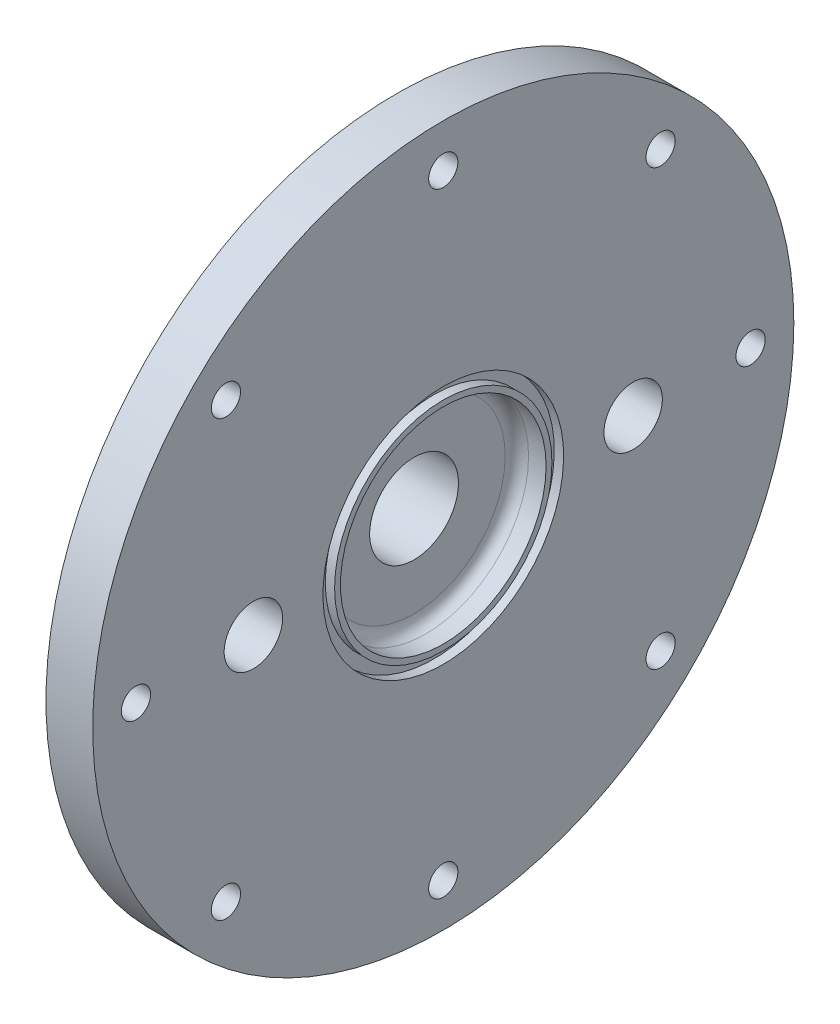
from build123d import *

# Parameters (mm, degrees)
CUT_EXTRUDE1_DEPTH      = 113.342968182
CUT_EXTRUDE1_DEPTH_BACK = 113.342968182
SKETCH2_R               = 6.35
SKETCH3_R               = 3.175
CUT_EXTRUDE2_DEPTH      = 113.342968182
CIRPATTERN1_COUNT       = 8
SKETCH4_W               = 2.032
SKETCH4_H               = 2.54


with BuildPart() as part:
    # Sketch1 → Revolve1 (revolve)
    with BuildSketch(Plane.XY, mode=Mode.PRIVATE) as revolve1_sk:
        with BuildLine():
            Line((0, 76.2), (-10.16, 76.2))
            Line((-10.16, 76.2), (-10.16, 21.082))
            ThreePointArc((-10.16, 21.082), (-11.647897552, 17.489897552), (-15.24, 16.002))
            Line((-15.24, 16.002), (-31.75, 16.002))
            Line((-31.75, 16.002), (-31.75, 9.652))
            Line((-31.75, 9.652), (-6.35, 9.652))
            Line((-6.35, 9.652), (-6.35, 19.812))
            ThreePointArc((-6.35, 19.812), (-5.606051224, 21.608051224), (-3.81, 22.352))
            Line((-3.81, 22.352), (0, 22.352))
            Line((0, 22.352), (0, 76.2))
        make_face()
    revolve(revolve1_sk.sketch.rotate(Axis((0, 0, 0), (-1, 0, 0)), 90), axis=Axis((0, 0, 0), (-1, 0, 0)))

    # Sketch2 → Cut-Extrude1 (cut, two sides: drawn at the far end of the back side and taken through both)
    with BuildSketch(Plane(origin=(0, 0, 0), x_dir=(0, 0, -1), z_dir=(1, 0, 0)).offset(-CUT_EXTRUDE1_DEPTH_BACK)):
        with Locations((41.275, 0)):
            Circle(SKETCH2_R)
        with Locations((-41.275, 0)):
            Circle(SKETCH2_R)
    extrude(amount=CUT_EXTRUDE1_DEPTH + CUT_EXTRUDE1_DEPTH_BACK, mode=Mode.SUBTRACT)

    # Sketch3 → Cut-Extrude2 (cut, through all)
    with BuildSketch(Plane(origin=(0, 0, 0), x_dir=(0, 0, -1), z_dir=(1, 0, 0))):
        with Locations((66.802, 0)):
            Circle(SKETCH3_R)
    cut_extrude2 = extrude(amount=-CUT_EXTRUDE2_DEPTH, mode=Mode.SUBTRACT)

    # CirPattern1: Cut-Extrude2 ×8 about axis
    cirpattern1_axis = Axis((0, 0, 0), (1, 0, 0))
    for i in range(1, CIRPATTERN1_COUNT):
        add(cut_extrude2.rotate(cirpattern1_axis, i * 360 / CIRPATTERN1_COUNT), mode=Mode.SUBTRACT)

    # Sketch4 → Cut-Revolve1 (revolve, cut)
    with BuildSketch(Plane.XY):
        with Locations((-1.016, 24.892)):
            Rectangle(SKETCH4_W, SKETCH4_H)
    revolve(axis=Axis((0, 0, 0), (-1, 0, 0)), mode=Mode.SUBTRACT)


solid = part.part
